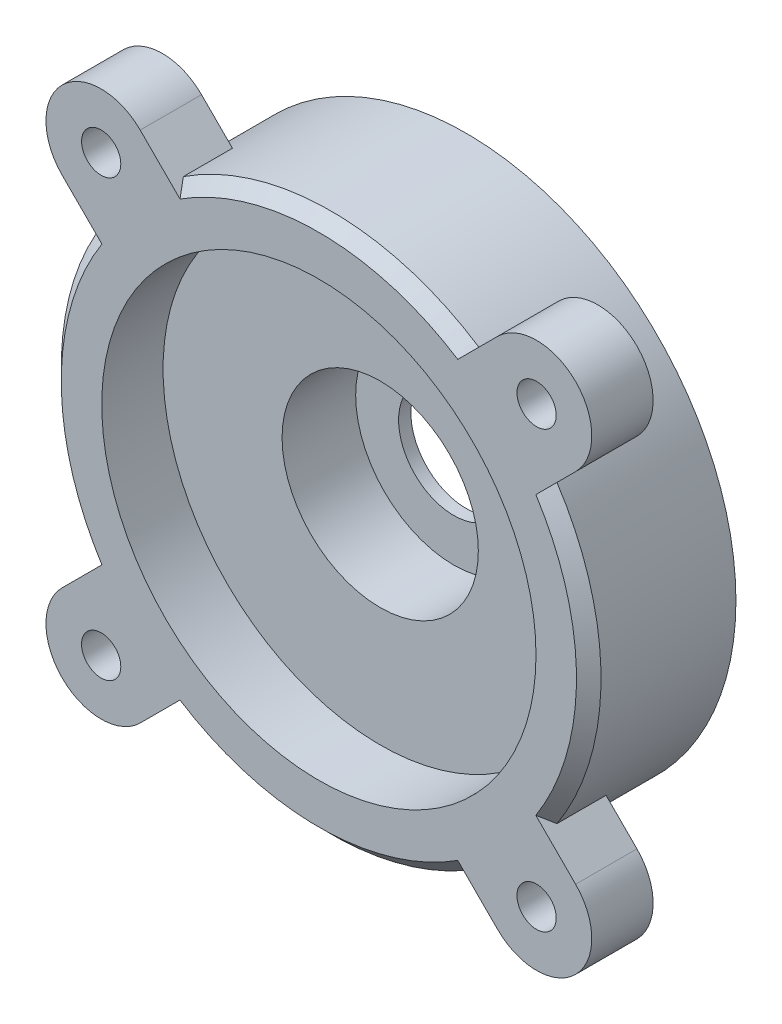
from build123d import *

# Parameters (mm, degrees)
SKETCH1_R           = 22
BOSS_EXTRUDE1_DEPTH = 6
CHAMFER1_SIZE       = 1
SKETCH8_R           = 1.6
BOSS_EXTRUDE2_DEPTH = 5
SKETCH9_R           = 17.7
CUT_EXTRUDE1_DEPTH  = 5
SKETCH10_R          = 8
CUT_EXTRUDE2_DEPTH  = 6
SKETCH11_R          = 4.5
CUT_EXTRUDE3_DEPTH  = 1


with BuildPart() as part:
    # Sketch1 → Boss-Extrude1 (new, symmetric)
    with BuildSketch(Plane.XY):
        Circle(SKETCH1_R)
    extrude(amount=BOSS_EXTRUDE1_DEPTH, both=True)

    # Chamfer1
    chamfer1_edges = [part.edges().sort_by_distance(p)[0] for p in [
        (-22, 0, 6),
    ]]
    chamfer(chamfer1_edges, length=CHAMFER1_SIZE)

    # Sketch8 → Boss-Extrude2 (add)
    # profile 1 of 4: a face of its own
    with BuildSketch(Plane.XY.offset(6)):
        with BuildLine():
            Line((14.566399692, 20.930360723), (11.322329189, 17.68629022))
            Line((11.322329189, 17.68629022), (17.68629022, 11.322329189))
            Line((17.68629022, 11.322329189), (20.930360723, 14.566399692))
            ThreePointArc((20.930360723, 14.566399692), (20.930360723, 20.930360723), (14.566399692, 20.930360723))
        make_face()
        with Locations((17.748380208, 17.748380208)):
            Circle(SKETCH8_R, mode=Mode.SUBTRACT)
    # profile 2 of 4: a face of its own
    with BuildSketch(Plane.XY.offset(6)):
        with BuildLine():
            Line((20.930360723, -14.566399692), (17.68629022, -11.322329189))
            Line((17.68629022, -11.322329189), (11.322329189, -17.68629022))
            Line((11.322329189, -17.68629022), (14.566399692, -20.930360723))
            ThreePointArc((14.566399692, -20.930360723), (20.930360723, -20.930360723), (20.930360723, -14.566399692))
        make_face()
        with Locations((17.748380208, -17.748380208)):
            Circle(SKETCH8_R, mode=Mode.SUBTRACT)
    # profile 3 of 4: a face of its own
    with BuildSketch(Plane.XY.offset(6)):
        with BuildLine():
            Line((-14.566399692, -20.930360723), (-11.322329189, -17.68629022))
            Line((-11.322329189, -17.68629022), (-17.68629022, -11.322329189))
            Line((-17.68629022, -11.322329189), (-20.930360723, -14.566399692))
            ThreePointArc((-20.930360723, -14.566399692), (-20.930360723, -20.930360723), (-14.566399692, -20.930360723))
        make_face()
        with Locations((-17.748380208, -17.748380208)):
            Circle(SKETCH8_R, mode=Mode.SUBTRACT)
    # profile 4 of 4: a face of its own
    with BuildSketch(Plane.XY.offset(6)):
        with BuildLine():
            Line((-20.930360723, 14.566399692), (-17.68629022, 11.322329189))
            Line((-17.68629022, 11.322329189), (-11.322329189, 17.68629022))
            Line((-11.322329189, 17.68629022), (-14.566399692, 20.930360723))
            ThreePointArc((-14.566399692, 20.930360723), (-20.930360723, 20.930360723), (-20.930360723, 14.566399692))
        make_face()
        with Locations((-17.748380208, 17.748380208)):
            Circle(SKETCH8_R, mode=Mode.SUBTRACT)
    extrude(amount=-BOSS_EXTRUDE2_DEPTH)

    # Sketch9 → Cut-Extrude1 (cut)
    with BuildSketch(Plane.XY.offset(6)):
        Circle(SKETCH9_R)
    extrude(amount=-CUT_EXTRUDE1_DEPTH, mode=Mode.SUBTRACT)

    # Sketch10 → Cut-Extrude2 (cut)
    with BuildSketch(Plane.XY.offset(1)):
        Circle(SKETCH10_R)
    extrude(amount=-CUT_EXTRUDE2_DEPTH, mode=Mode.SUBTRACT)

    # Sketch11 → Cut-Extrude3 (cut)
    with BuildSketch(Plane.XY.offset(-5)):
        Circle(SKETCH11_R)
    extrude(amount=-CUT_EXTRUDE3_DEPTH, mode=Mode.SUBTRACT)


solid = part.part
